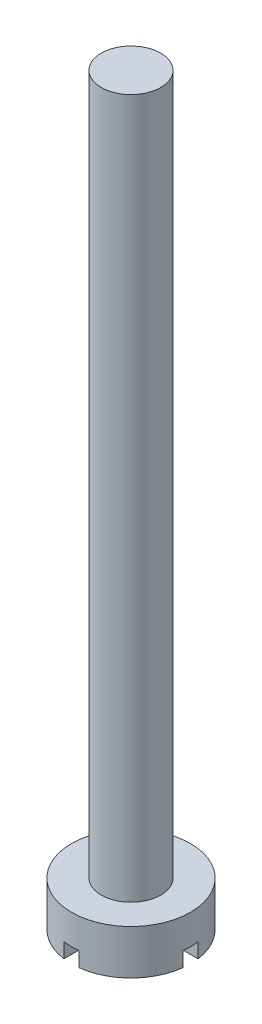
from build123d import *

# Parameters (mm, degrees)
SKETCH1_R           = 4
SKETCH1_R_2         = 2
BOSS_EXTRUDE1_DEPTH = 3
SKETCH1_3_R         = 2
BOSS_EXTRUDE2_DEPTH = 50
SKETCH2_W           = 1.011920828
SKETCH2_H           = 8.527541141
SKETCH2_W_2         = 8.717276296
SKETCH2_H_2         = 1.011920828
CUT_EXTRUDE1_DEPTH  = 1


with BuildPart() as part:
    # Sketch1 → Boss-Extrude1 (new body)
    with BuildSketch(Plane(origin=(0, 0, 0), x_dir=(1, 0, 0), z_dir=(0, 1, 0))):
        with Locations(Location((0, 0, 0), (0, 0, 270))):
            Circle(SKETCH1_R)
        with Locations(Location((0, 0, 0), (0, 0, 270))):
            Circle(SKETCH1_R_2, mode=Mode.SUBTRACT)
    extrude(amount=BOSS_EXTRUDE1_DEPTH)

    # Sketch1<3> → Boss-Extrude2 (add)
    with BuildSketch(Plane(origin=(0, 0, 0), x_dir=(1, 0, 0), z_dir=(0, 1, 0))):
        with Locations(Location((0, 0, 0), (0, 0, 270))):
            Circle(SKETCH1_3_R)
    extrude(amount=BOSS_EXTRUDE2_DEPTH)

    # Sketch2 → Cut-Extrude1 (cut)
    with BuildSketch(Plane(origin=(0, 0, 0), x_dir=(-1, 0, 0), z_dir=(0, -1, 0))):
        with Locations((0.042163368, -0.073785894)):
            Rectangle(SKETCH2_W, SKETCH2_H)
        with Locations((-0.026352105, 0.036892947)):
            Rectangle(SKETCH2_W_2, SKETCH2_H_2)
    extrude(amount=-CUT_EXTRUDE1_DEPTH, mode=Mode.SUBTRACT)


solid = part.part
